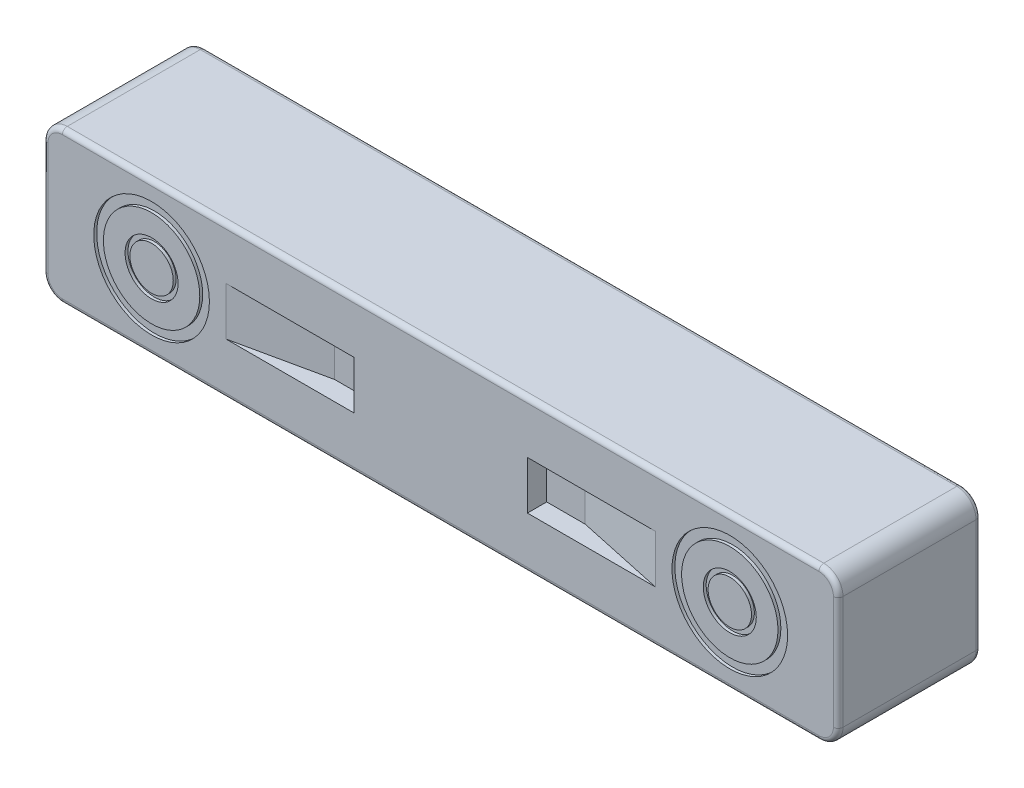
from build123d import *

# Parameters (mm, degrees)
SKETCH_1_W          = 165
SKETCH_1_H          = 31.5
EXTRUDE_1_DEPTH     = 29.6
SKETCH_2_R          = 12
SKETCH_2_R_2        = 10
SKETCH_2_R_3        = 5.5
SKETCH_2_R_4        = 4.5
CUT_EXTRUDE_1_DEPTH = 0.6
FILLET_1_R          = 4
FILLET_2_R          = 1
SKETCH_3_W          = 8
SKETCH_3_H          = 10
CUT_EXTRUDE_2_DEPTH = 4
CUT_EXTRUDE_3_DEPTH = 10
SCALE_1_SCALE       = 0.5


with BuildPart() as part:
    # 草图1 → 凸台-拉伸1 (new body)
    with BuildSketch(Plane.XY):
        Rectangle(SKETCH_1_W, SKETCH_1_H)
    extrude(amount=EXTRUDE_1_DEPTH)

    # 草图2 → 切除-拉伸1 (cut)
    # profile 1 of 4: a face of its own
    with BuildSketch(Plane.XY.offset(29.6)):
        with Locations((-60, 0)):
            Circle(SKETCH_2_R)
        with Locations((-60, 0)):
            Circle(SKETCH_2_R_2, mode=Mode.SUBTRACT)
    # profile 2 of 4: a face of its own
    with BuildSketch(Plane.XY.offset(29.6)):
        with Locations((-60, 0)):
            Circle(SKETCH_2_R_3)
        with Locations((-60, 0)):
            Circle(SKETCH_2_R_4, mode=Mode.SUBTRACT)
    # profile 3 of 4: a face of its own
    with BuildSketch(Plane.XY.offset(29.6)):
        with Locations((60, 0)):
            Circle(SKETCH_2_R)
        with Locations((60, 0)):
            Circle(SKETCH_2_R_2, mode=Mode.SUBTRACT)
    # profile 4 of 4: a face of its own
    with BuildSketch(Plane.XY.offset(29.6)):
        with Locations((60, 0)):
            Circle(SKETCH_2_R_3)
        with Locations((60, 0)):
            Circle(SKETCH_2_R_4, mode=Mode.SUBTRACT)
    extrude(amount=-CUT_EXTRUDE_1_DEPTH, mode=Mode.SUBTRACT)

    # 圆角1
    fillet_1_edges = [part.edges().sort_by_distance(p)[0] for p in [
        (82.5, -15.75, 14.8),
        (-82.5, -15.75, 14.8),
        (-82.5, 15.75, 14.8),
        (82.5, 15.75, 14.8),
    ]]
    fillet(fillet_1_edges, radius=FILLET_1_R)

    # 圆角2
    fillet_2_edges = [part.edges().sort_by_distance(p)[0] for p in [
        (82.5, 0, 0),
        (82.5, 0, 29.6),
        (0, -15.75, 0),
        (-82.5, 0, 0),
        (0, 15.75, 0),
        (-81.328427125, 14.578427125, 0),
        (-81.328427125, -14.578427125, 0),
        (81.328427125, 14.578427125, 0),
        (81.328427125, -14.578427125, 0),
        (0, -15.75, 29.6),
        (0, 15.75, 29.6),
        (-82.5, 0, 29.6),
        (-81.328427125, 14.578427125, 29.6),
        (-81.328427125, -14.578427125, 29.6),
        (81.328427125, 14.578427125, 29.6),
        (81.328427125, -14.578427125, 29.6),
    ]]
    fillet(fillet_2_edges, radius=FILLET_2_R)

    # 草图3 → 切除-拉伸2 (cut)
    with BuildSketch(Plane.XY.offset(29.6)):
        with Locations((-22, 0)):
            Rectangle(SKETCH_3_W, SKETCH_3_H)
        with Locations((22, 0)):
            Rectangle(SKETCH_3_W, SKETCH_3_H)
    extrude(amount=-CUT_EXTRUDE_2_DEPTH, mode=Mode.SUBTRACT)

    # 草图4 → 切除-拉伸3 (cut)
    with BuildSketch(Plane.XZ.offset(-5)):
        Polygon((26, 25.6), (44.574175621, 29.6), (26, 29.6), align=None)
        Polygon((-26, 29.6), (-44.574175621, 29.6), (-26, 25.6), align=None)
    extrude(amount=CUT_EXTRUDE_3_DEPTH, mode=Mode.SUBTRACT)


with BuildPart() as part_1:
    # 缩放比例1: scaled about (0, 0, 14.660574606)
    add(part.part.scale(SCALE_1_SCALE).moved(Location((0, 0, 7.330287303))))


solid = part_1.part
